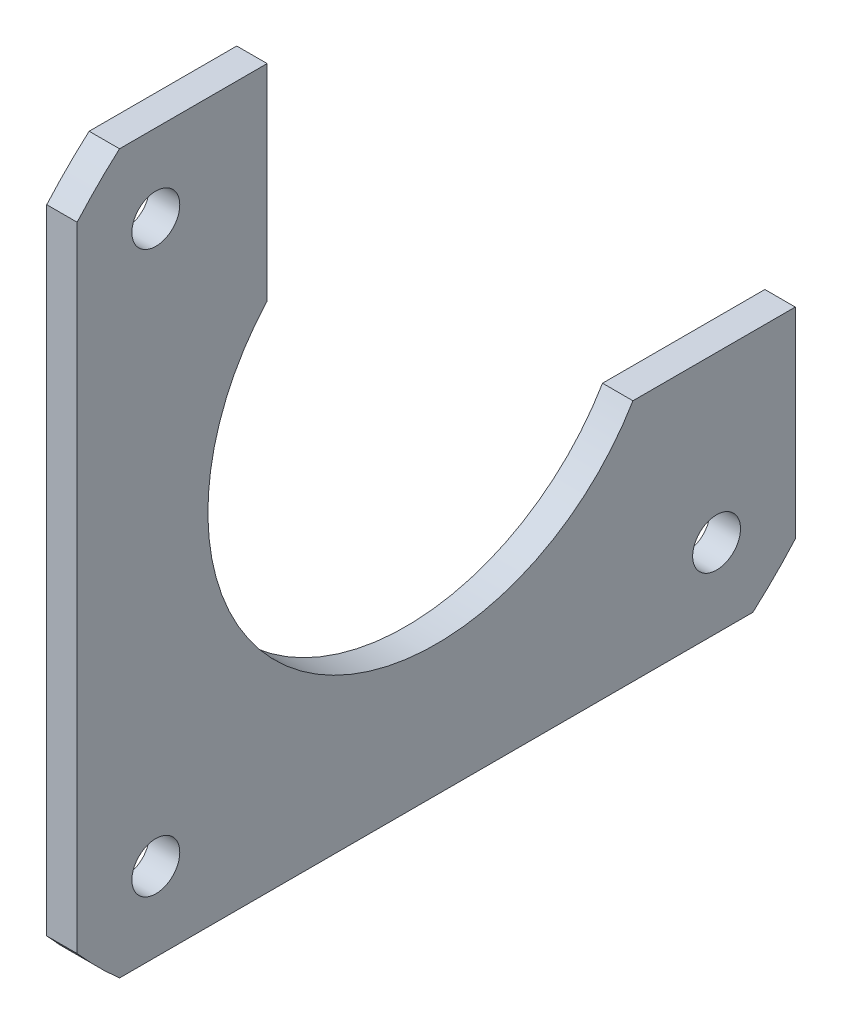
from build123d import *

# Parameters (mm, degrees)
SKETCH1_R           = 19.075
SKETCH1_R_2         = 2.675
BOSS_EXTRUDE1_DEPTH = 2.54
BOSS_EXTRUDE2_START = -2.54
SKETCH2_R           = 2.675
SKETCH2_R_2         = 2
BOSS_EXTRUDE2_DEPTH = 2.54
CUT_EXTRUDE1_DEPTH  = 43.502371699


with BuildPart() as part:
    # Sketch1 → Boss-Extrude1 (new body)
    with BuildSketch(Plane(origin=(0, 0, 0), x_dir=(0, 0, -1), z_dir=(1, 0, 0))):
        with BuildLine():
            Line((-30, 26.457513111), (-30, -26.457513111))
            ThreePointArc((-30, -26.457513111), (-28.284271247, -28.284271247), (-26.457513111, -30))
            Line((-26.457513111, -30), (26.457513111, -30))
            ThreePointArc((26.457513111, -30), (28.284271247, -28.284271247), (30, -26.457513111))
            Line((30, -26.457513111), (30, 26.457513111))
            ThreePointArc((30, 26.457513111), (28.284271247, 28.284271247), (26.457513111, 30))
            Line((26.457513111, 30), (-26.457513111, 30))
            ThreePointArc((-26.457513111, 30), (-28.284271247, 28.284271247), (-30, 26.457513111))
        make_face()
        Circle(SKETCH1_R, mode=Mode.SUBTRACT)
        with Locations((-23.425, -23.425)):
            Circle(SKETCH1_R_2, mode=Mode.SUBTRACT)
        with Locations((23.425, -23.425)):
            Circle(SKETCH1_R_2, mode=Mode.SUBTRACT)
        with Locations((23.425, 23.425)):
            Circle(SKETCH1_R_2, mode=Mode.SUBTRACT)
        with Locations((-23.425, 23.425)):
            Circle(SKETCH1_R_2, mode=Mode.SUBTRACT)
    extrude(amount=BOSS_EXTRUDE1_DEPTH)

    # Sketch2 → Boss-Extrude2 (add)
    # profile 1 of 4: a face of its own
    with BuildSketch(Plane(origin=(2.54, 0, 0), x_dir=(0, 0, -1), z_dir=(1, 0, 0)).offset(BOSS_EXTRUDE2_START)):
        with Locations((-23.425, -23.425)):
            Circle(SKETCH2_R)
        with Locations((-23.425, -23.425)):
            Circle(SKETCH2_R_2, mode=Mode.SUBTRACT)
    # profile 2 of 4: a face of its own
    with BuildSketch(Plane(origin=(2.54, 0, 0), x_dir=(0, 0, -1), z_dir=(1, 0, 0)).offset(BOSS_EXTRUDE2_START)):
        with Locations((23.425, 23.425)):
            Circle(SKETCH2_R)
        with Locations((23.425, 23.425)):
            Circle(SKETCH2_R_2, mode=Mode.SUBTRACT)
    # profile 3 of 4: a face of its own
    with BuildSketch(Plane(origin=(2.54, 0, 0), x_dir=(0, 0, -1), z_dir=(1, 0, 0)).offset(BOSS_EXTRUDE2_START)):
        with Locations((23.425, -23.425)):
            Circle(SKETCH2_R)
        with Locations((23.425, -23.425)):
            Circle(SKETCH2_R_2, mode=Mode.SUBTRACT)
    # profile 4 of 4: a face of its own
    with BuildSketch(Plane(origin=(2.54, 0, 0), x_dir=(0, 0, -1), z_dir=(1, 0, 0)).offset(BOSS_EXTRUDE2_START)):
        with Locations((-23.425, 23.425)):
            Circle(SKETCH2_R)
        with Locations((-23.425, 23.425)):
            Circle(SKETCH2_R_2, mode=Mode.SUBTRACT)
    extrude(amount=BOSS_EXTRUDE2_DEPTH)

    # Sketch3 → Cut-Extrude1 (cut, through all)
    with BuildSketch(Plane(origin=(2.54, 0, 0), x_dir=(0, 0, -1), z_dir=(1, 0, 0))):
        Polygon((-14.125, 30), (-14.125, 12.819516372), (16.436338552, -9.68), (30, -9.68), (30, 30), align=None)
    extrude(amount=-CUT_EXTRUDE1_DEPTH, mode=Mode.SUBTRACT)


solid = part.part
